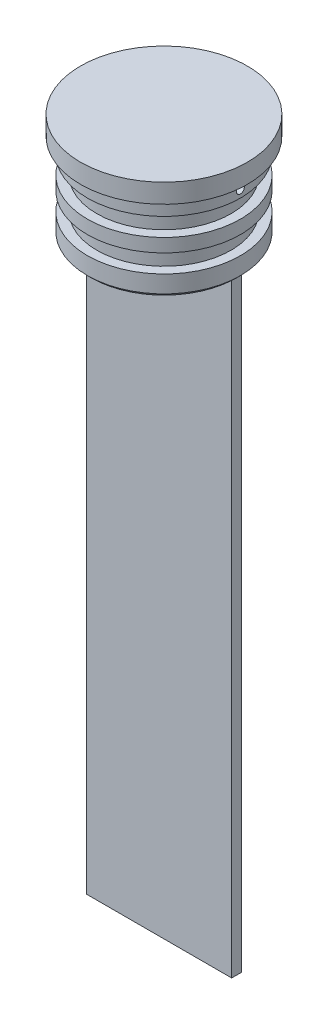
from build123d import *

# Parameters (mm, degrees)
CHAMFER1_SIZE           = 0.508
SKETCH2_W               = 19.211267794
SKETCH2_H               = 1.27
BOSS_EXTRUDE1_DEPTH     = 80.01
FILLET1_R               = 0.127
CUT_EXTRUDE1_DEPTH      = 82.521536431
CUT_EXTRUDE1_DEPTH_BACK = 82.521536431
SKETCH3_R               = 0.5334


with BuildPart() as part:
    # Sketch1 → Revolve1 (revolve)
    with BuildSketch(Plane.XY, mode=Mode.PRIVATE) as revolve1_sk:
        Polygon((0, 13.97), (-11.049, 13.97), (-11.049, 11.43), (-10.1346, 11.43), (-10.1346, 9.398), (-8.89, 9.398), (-8.89, 6.985), (-10.1346, 6.985), (-10.1346, 5.207), (-8.89, 5.207), (-8.89, 2.794), (-10.1346, 2.794), (-10.1346, 0), (0, 0), align=None)
    revolve(revolve1_sk.sketch.rotate(Axis((0, 20.368840099, 0), (0, -1, 0)), 270), axis=Axis((0, 20.368840099, 0), (0, -1, 0)))

    # Chamfer1
    chamfer1_edges = [part.edges().sort_by_distance(p)[0] for p in [
        (0, 0, -10.1346),
    ]]
    chamfer(chamfer1_edges, length=CHAMFER1_SIZE)

    # Sketch2 → Boss-Extrude1 (add)
    with BuildSketch(Plane.XZ):
        Rectangle(SKETCH2_W, SKETCH2_H)
    extrude(amount=BOSS_EXTRUDE1_DEPTH)

    # Fillet1
    fillet1_edges = [part.edges().sort_by_distance(p)[0] for p in [
        (0, 11.43, -10.1346),
    ]]
    fillet(fillet1_edges, radius=FILLET1_R)

    # Sketch3 → Cut-Extrude1 (cut, two sides: drawn at the far end of the back side and taken through both)
    with BuildSketch(Plane(origin=(0, 0, 0), x_dir=(0, 0, -1), z_dir=(1, 0, 0)).offset(-CUT_EXTRUDE1_DEPTH_BACK)):
        with Locations((0, 10.414)):
            Circle(SKETCH3_R)
    extrude(amount=CUT_EXTRUDE1_DEPTH + CUT_EXTRUDE1_DEPTH_BACK, mode=Mode.SUBTRACT)


solid = part.part
